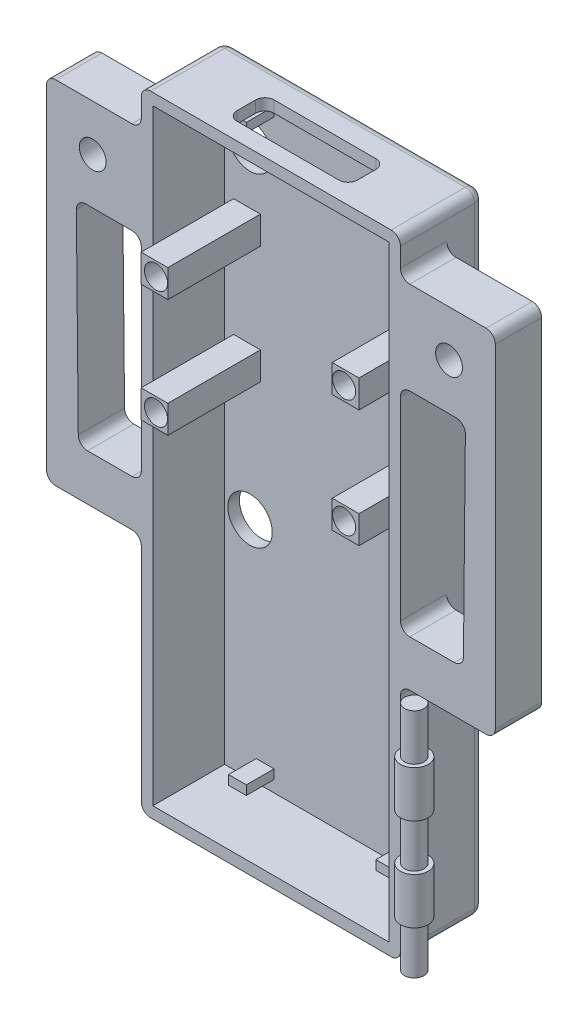
from build123d import *

# Parameters (mm, degrees)
SKETCH1_W                 = 28
SKETCH1_H                 = 68
BOSS_EXTRUDE1_DEPTH       = 1.25
SKETCH21_W                = 1.925
SKETCH21_H                = 1
BOSS_EXTRUDE10_DEPTH      = 3
SKETCH22_W                = 2.89
SKETCH22_H                = 3
SKETCH22_R                = 1.25
BOSS_EXTRUDE11_DEPTH      = 10
SKETCH7_W                 = 28
SKETCH7_H                 = 68
SKETCH7_W_2               = 25.5
SKETCH7_H_2               = 65.5
BOSS_EXTRUDE4_DEPTH       = 7.75
SKETCH18_W                = 13
SKETCH18_H                = 4
CUT_EXTRUDE10_DEPTH       = 1.25
SKETCH13_R                = 1.05
BOSS_EXTRUDE7_DEPTH       = 5
LPATTERN2_COUNT           = 4
LPATTERN2_PITCH           = 5
SKETCH14_W                = 10
SKETCH14_H                = 5
CUT_EXTRUDE5_DEPTH        = 5
FILLET1_R                 = 1
FILLET7_R                 = 1
M4_CLEARANCE_HOLE1_D      = 4.8
SKETCH26_R                = 1.45
BOSS_EXTRUDE12_DEPTH      = 5
FILLET10_R                = 1
FILLET12_R                = 1
BOSS_EXTRUDE13_DEPTH      = 5
BOSS_EXTRUDE13_DEPTH_BACK = 20
SKETCH28_R                = 1.05
CUT_EXTRUDE11_DEPTH       = 44.250722537
CUT_EXTRUDE11_DEPTH_BACK  = 44.250722537
SKETCH29_R                = 1.25


with BuildPart() as part:
    # Sketch1 → Boss-Extrude1 (new body)
    with BuildSketch(Plane.XY):
        Rectangle(SKETCH1_W, SKETCH1_H)
    extrude(amount=BOSS_EXTRUDE1_DEPTH)

    # Sketch21 → Boss-Extrude10 (add)
    with BuildSketch(Plane.XY.offset(1.25)):
        with Locations((-8.365871065, 31)):
            Rectangle(SKETCH21_W, SKETCH21_H)
        with Locations((7.559128935, 31)):
            Rectangle(SKETCH21_W, SKETCH21_H)
        with Locations((7.559128935, -30.993333443)):
            Rectangle(SKETCH21_W, SKETCH21_H)
        with Locations((-8.365871065, -30.993333443)):
            Rectangle(SKETCH21_W, SKETCH21_H)
    extrude(amount=BOSS_EXTRUDE10_DEPTH)

    # Sketch22 → Boss-Extrude11 (add)
    # profile 1 of 4: a face of its own
    with BuildSketch(Plane.XY.offset(1.25)):
        with Locations((10.326628935, 19.170761532)):
            Rectangle(SKETCH22_W, SKETCH22_H)
        with Locations((10.16, 19.170761532)):
            Circle(SKETCH22_R, mode=Mode.SUBTRACT)
    # profile 2 of 4: a face of its own
    with BuildSketch(Plane.XY.offset(1.25)):
        with Locations((-10.326628935, 19.170761532)):
            Rectangle(SKETCH22_W, SKETCH22_H)
        with Locations(Location((-10.16, 19.170761532, 0), (0, 0, 180))):
            Circle(SKETCH22_R, mode=Mode.SUBTRACT)
    # profile 3 of 4: a face of its own
    with BuildSketch(Plane.XY.offset(1.25)):
        with Locations((10.326628935, 6.470761532)):
            Rectangle(SKETCH22_W, SKETCH22_H)
        with Locations(Location((10.16, 6.470761532, 0), (0, 0, 180))):
            Circle(SKETCH22_R, mode=Mode.SUBTRACT)
    # profile 4 of 4: a face of its own
    with BuildSketch(Plane.XY.offset(1.25)):
        with Locations((-10.326628935, 6.470761532)):
            Rectangle(SKETCH22_W, SKETCH22_H)
        with Locations((-10.16, 6.470761532)):
            Circle(SKETCH22_R, mode=Mode.SUBTRACT)
    extrude(amount=BOSS_EXTRUDE11_DEPTH)

    # Sketch7 → Boss-Extrude4 (add)
    with BuildSketch(Plane.XY.offset(1.25)):
        Rectangle(SKETCH7_W, SKETCH7_H)
        Rectangle(SKETCH7_W_2, SKETCH7_H_2, mode=Mode.SUBTRACT)
    extrude(amount=BOSS_EXTRUDE4_DEPTH)

    # Sketch18 → Cut-Extrude10 (cut)
    with BuildSketch(Plane(origin=(0, 34, 0), x_dir=(1, 0, 0), z_dir=(0, 1, 0))):
        with Locations((0, -5.15)):
            Rectangle(SKETCH18_W, SKETCH18_H)
    extrude(amount=-CUT_EXTRUDE10_DEPTH, mode=Mode.SUBTRACT)

    # Sketch13 → Boss-Extrude7 (add)
    with BuildSketch(Plane.XZ.offset(34)):
        with BuildLine():
            Line((15.5, 7.5), (14, 6.303164343))
            Line((14, 6.303164343), (14, 9))
            ThreePointArc((14, 9), (16.560660172, 10.060660172), (15.5, 7.5))
        make_face()
        with Locations(Location((15.5, 9, 0), (0, 0, 270))):
            Circle(SKETCH13_R, mode=Mode.SUBTRACT)
    boss_extrude7 = extrude(amount=-BOSS_EXTRUDE7_DEPTH)

    # LPattern2: Boss-Extrude7 ×4, 1 skipped
    with Locations(*[(0, i * LPATTERN2_PITCH, 0) for i in range(1, LPATTERN2_COUNT) if i not in (2,)]):
        add(boss_extrude7)

    # Sketch14 → Cut-Extrude5 (cut)
    with BuildSketch(Plane(origin=(14, 0, 0), x_dir=(0, 0, -1), z_dir=(1, 0, 0))):
        with Locations((-6.85234732, -31.5)):
            Rectangle(SKETCH14_W, SKETCH14_H)
    extrude(amount=CUT_EXTRUDE5_DEPTH, mode=Mode.SUBTRACT)

    # Fillet1
    fillet1_edges = [part.edges().sort_by_distance(p)[0] for p in [
        (14, -34, 4.5),
        (0, 34, 0),
        (14, 0, 0),
        (0, -34, 0),
        (-14, 0, 0),
        (-14, 34, 4.5),
        (14, 34, 4.5),
        (-14, -34, 4.5),
    ]]
    fillet(fillet1_edges, radius=FILLET1_R)

    # Fillet7
    fillet7_edges = [part.edges().sort_by_distance(p)[0] for p in [
        (-6.5, 33.375, 3.15),
        (-6.5, 33.375, 7.15),
        (6.5, 33.375, 7.15),
        (6.5, 33.375, 3.15),
    ]]
    fillet(fillet7_edges, radius=FILLET7_R)

    # M4 Clearance Hole1 (through all)
    with Locations(Plane.XY.offset(1.25)):
        with Locations((-10, 26.525248178), (10, 26.525248178), (10, -8.474751822), (-10, -8.474751822)):
            Hole(M4_CLEARANCE_HOLE1_D / 2)

    # Sketch26 → Boss-Extrude12 (add)
    with BuildSketch(Plane.XY.offset(9)):
        Polygon((-14, 29.939793189), (-24.25, 29.939793189), (-24.25, -8.060206811), (-14, -8.060206811), (-14, -3.060206811), (-20.799999976, -3.060206811), (-21.025, 19.939793189), (-14, 19.939793189), align=None)
        with Locations((-19.25, 24.941355933)):
            Circle(SKETCH26_R, mode=Mode.SUBTRACT)
    boss_extrude12 = extrude(amount=-BOSS_EXTRUDE12_DEPTH)

    # Fillet10
    fillet10_edges = [part.edges().sort_by_distance(p)[0] for p in [
        (-14, 29.939793189, 6.5),
        (-14, 19.939793189, 6.5),
        (-21.025, 19.939793189, 6.5),
        (-20.799999976, -3.060206811, 6.5),
        (-14, -3.060206811, 6.5),
        (-14, -8.060206811, 6.5),
        (-24.25, -8.060206811, 6.5),
        (-24.25, 29.939793189, 6.5),
    ]]
    fillet(fillet10_edges, radius=FILLET10_R)

    # Mirror2: Boss-Extrude12 across plane
    add(boss_extrude12.mirror(Plane.ZY))

    # Fillet12
    fillet12_edges = [part.edges().sort_by_distance(p)[0] for p in [
        (14, 19.939793189, 6.5),
        (14, 29.939793189, 6.5),
        (24.25, 29.939793189, 6.5),
        (24.25, -8.060206811, 6.5),
        (14, -8.060206811, 6.5),
        (14, -3.060206811, 6.5),
        (20.799999976, -3.060206811, 6.5),
        (21.025, 19.939793189, 6.5),
    ]]
    fillet(fillet12_edges, radius=FILLET12_R)

    # Sketch28 → Boss-Extrude13 (add, two sides: drawn at the far end of the back side and taken through both)
    with BuildSketch(Plane(origin=(0, -29, 0), x_dir=(-1, 0, 0), z_dir=(0, -1, 0)).offset(-BOSS_EXTRUDE13_DEPTH_BACK)):
        with Locations(Location((-15.5, -9, 0), (0, 0, 180))):
            Circle(SKETCH28_R)
    extrude(amount=BOSS_EXTRUDE13_DEPTH + BOSS_EXTRUDE13_DEPTH_BACK)

    # Sketch29 → Cut-Extrude11 (cut, two sides: drawn at the far end of the back side and taken through both)
    with BuildSketch(Plane.XY.offset(11.25).offset(-CUT_EXTRUDE11_DEPTH_BACK)):
        with Locations(Location((-10.16, 19.170761532, 0), (0, 0, 180))):
            Circle(SKETCH29_R)
        with Locations((-10.16, 6.470761532)):
            Circle(SKETCH29_R)
        with Locations(Location((10.16, 6.470761532, 0), (0, 0, 180))):
            Circle(SKETCH29_R)
        with Locations((10.16, 19.170761532)):
            Circle(SKETCH29_R)
    extrude(amount=CUT_EXTRUDE11_DEPTH + CUT_EXTRUDE11_DEPTH_BACK, mode=Mode.SUBTRACT)


solid = part.part
